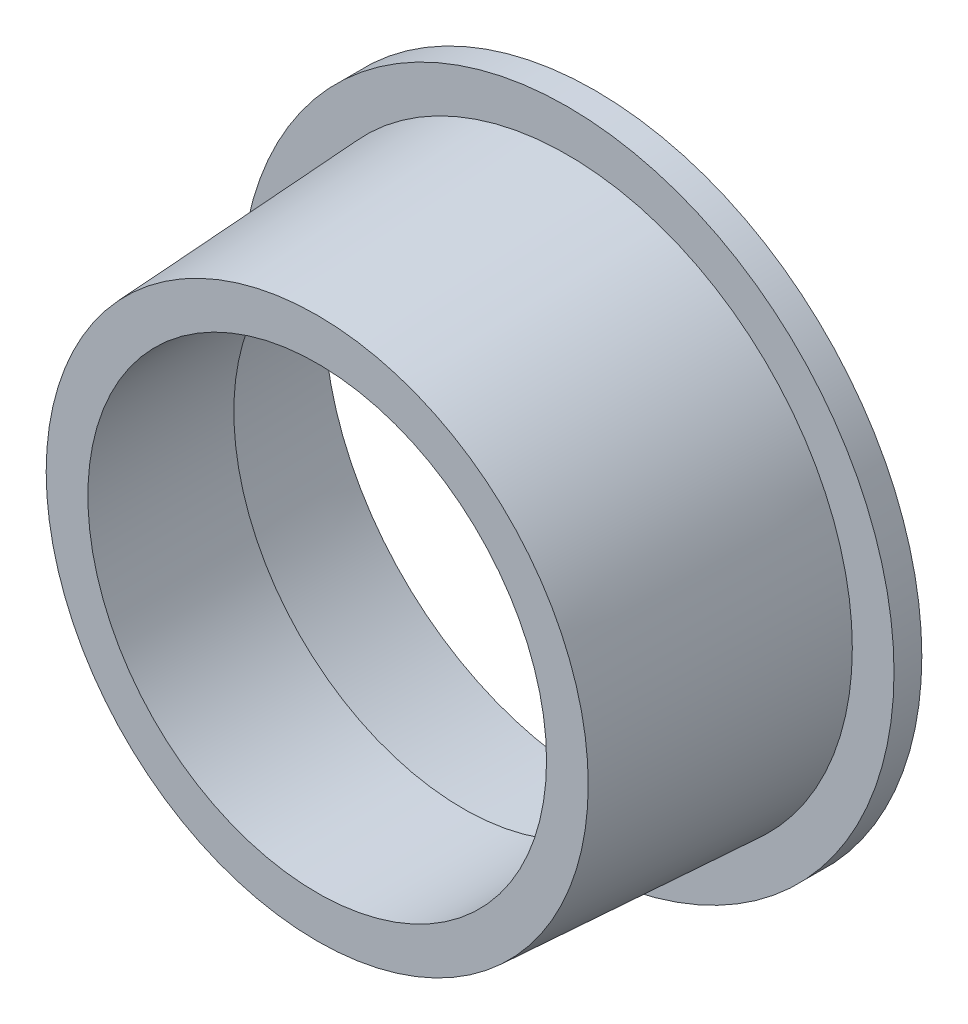
from build123d import *


with BuildPart() as part:
    # Sketch1 → Revolve1 (revolve)
    with BuildSketch(Plane(origin=(0, 0, 0), x_dir=(-1, 0, 0), z_dir=(0, 1, 0)), mode=Mode.PRIVATE) as revolve1_sk:
        Polygon((19.5, 0), (19.25, 8), (16.5, 9.5), (16.5, 20), (19.5, 20), (20.5, 2), (23.5, 2), (23.5, 0), align=None)
    revolve(revolve1_sk.sketch.rotate(Axis((0, 0, 20), (0, 0, -1)), 180), axis=Axis((0, 0, 20), (0, 0, -1)))


solid = part.part
